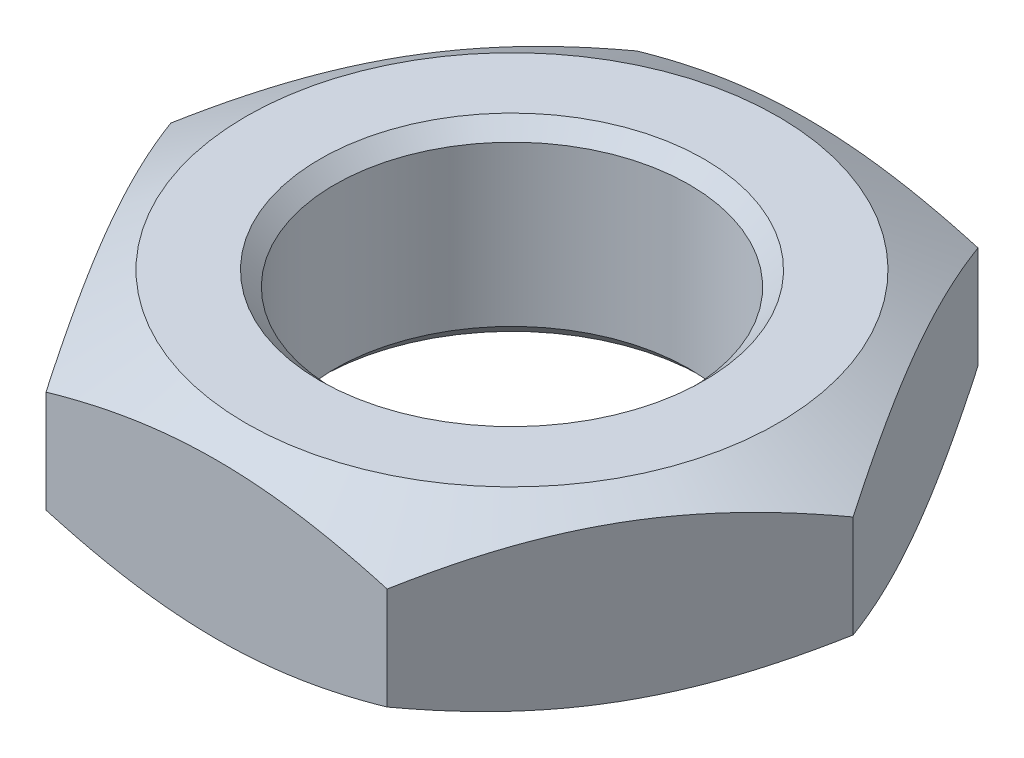
from build123d import *

# Parameters (mm, degrees)
EXTRUDE_1_DEPTH     = 3.2
SKETCH_2_R          = 3
CUT_EXTRUDE_1_DEPTH = 5
CHAMFER_1_SIZE      = 0.25


with BuildPart() as part:
    # Эскиз1 → Вытянуть1 (new body)
    with BuildSketch(Plane(origin=(0, 0, 0), x_dir=(1, 0, 0), z_dir=(0, 1, 0))):
        Polygon((-2.886751346, 5), (2.886751346, 5), (5.773502692, 0), (2.886751346, -5), (-2.886751346, -5), (-5.773502692, 0), align=None)
    extrude(amount=EXTRUDE_1_DEPTH)

    # Эскиз2 → Вырез-Вытянуть1 (cut)
    with BuildSketch(Plane(origin=(0, 3.2, 0), x_dir=(-1, 0, 0), z_dir=(0, 1, 0))):
        with Locations(Location((0, 0, 0), (0, 0, 90))):
            Circle(SKETCH_2_R)
    extrude(amount=-CUT_EXTRUDE_1_DEPTH, mode=Mode.SUBTRACT)

    # Эскиз3 → Вырез-Повернуть1 (revolve, cut)
    with BuildSketch(Plane.XY, mode=Mode.PRIVATE) as cut_revolve_1_sk:
        Polygon((-4.5, 3.2), (-6.5, 2.045299462), (-6.5, 3.2), align=None)
        Polygon((-4.5, 0), (-6.5, 1.154700538), (-6.5, 0), align=None)
    revolve(cut_revolve_1_sk.sketch.rotate(Axis((0, 3.2, 0), (0, -1, 0)), 60.000000114), axis=Axis((0, 3.2, 0), (0, -1, 0)), mode=Mode.SUBTRACT)

    # Фаска1
    chamfer_1_edges = [part.edges().sort_by_distance(p)[0] for p in [
        (0, 0, -3),
        (0, 3.2, -3),
    ]]
    chamfer(chamfer_1_edges, length=CHAMFER_1_SIZE)


solid = part.part
